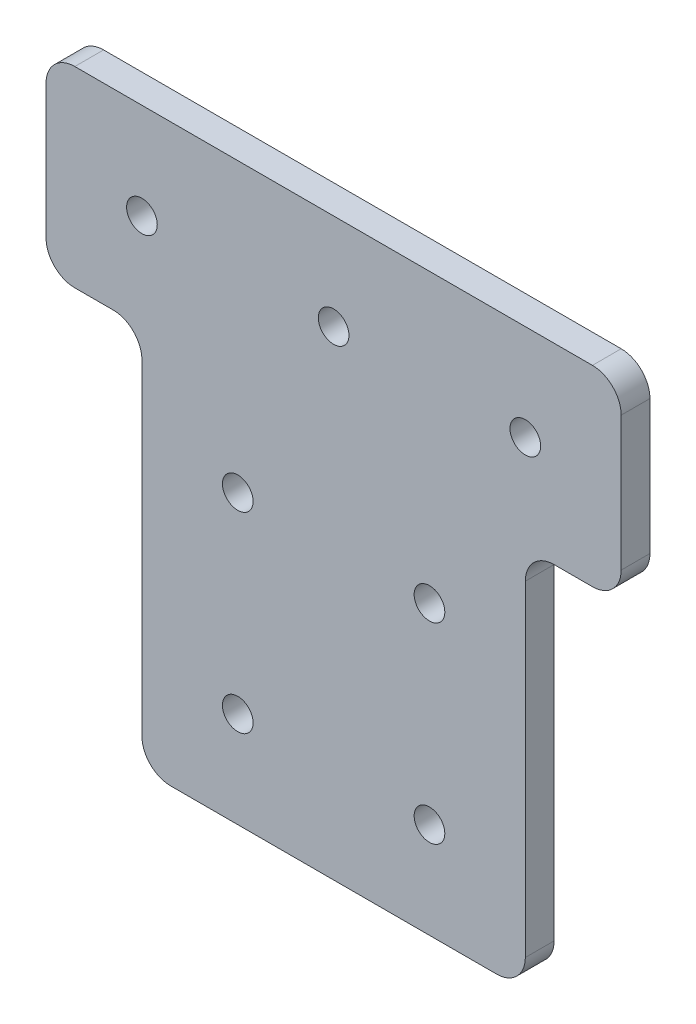
from build123d import *

# Parameters (mm, degrees)
EXTRUDE_1_DEPTH     = 3
CUT_EXTRUDE_1_REACH = 52.09
SKETCH_2_R          = 1.6
FILLET_1_R          = 3
FILLET_2_R          = 3


with BuildPart() as part:
    # 草图1 → 凸台-拉伸1 (new body)
    with BuildSketch(Plane.XY):
        Polygon((-20, 20), (-30, 20), (-30, 40), (30, 40), (30, 20), (20, 20), (20, -20), (-20, -20), align=None)
    extrude(amount=EXTRUDE_1_DEPTH)

    # 草图2 → 切除-拉伸1 (cut, up to next)
    with BuildSketch(Plane.XY.offset(3), mode=Mode.PRIVATE) as cut_extrude_1_sk1:
        with Locations((-20, 30)):
            Circle(SKETCH_2_R)
    cut_extrude_1_tool1 = extrude(cut_extrude_1_sk1.sketch, amount=-CUT_EXTRUDE_1_REACH, mode=Mode.PRIVATE) & part.part
    # 草图2 → 切除-拉伸1 (cut, up to next)
    with BuildSketch(Plane.XY.offset(3), mode=Mode.PRIVATE) as cut_extrude_1_sk2:
        with Locations((0, 30)):
            Circle(SKETCH_2_R)
    cut_extrude_1_tool2 = extrude(cut_extrude_1_sk2.sketch, amount=-CUT_EXTRUDE_1_REACH, mode=Mode.PRIVATE) & part.part
    # 草图2 → 切除-拉伸1 (cut, up to next)
    with BuildSketch(Plane.XY.offset(3), mode=Mode.PRIVATE) as cut_extrude_1_sk3:
        with Locations((20, 30)):
            Circle(SKETCH_2_R)
    cut_extrude_1_tool3 = extrude(cut_extrude_1_sk3.sketch, amount=-CUT_EXTRUDE_1_REACH, mode=Mode.PRIVATE) & part.part
    # 草图2 → 切除-拉伸1 (cut, up to next)
    with BuildSketch(Plane.XY.offset(3), mode=Mode.PRIVATE) as cut_extrude_1_sk4:
        with Locations((-10, -10)):
            Circle(SKETCH_2_R)
    cut_extrude_1_tool4 = extrude(cut_extrude_1_sk4.sketch, amount=-CUT_EXTRUDE_1_REACH, mode=Mode.PRIVATE) & part.part
    # 草图2 → 切除-拉伸1 (cut, up to next)
    with BuildSketch(Plane.XY.offset(3), mode=Mode.PRIVATE) as cut_extrude_1_sk5:
        with Locations((10, -10)):
            Circle(SKETCH_2_R)
    cut_extrude_1_tool5 = extrude(cut_extrude_1_sk5.sketch, amount=-CUT_EXTRUDE_1_REACH, mode=Mode.PRIVATE) & part.part
    # 草图2 → 切除-拉伸1 (cut, up to next)
    with BuildSketch(Plane.XY.offset(3), mode=Mode.PRIVATE) as cut_extrude_1_sk6:
        with Locations((10, 10)):
            Circle(SKETCH_2_R)
    cut_extrude_1_tool6 = extrude(cut_extrude_1_sk6.sketch, amount=-CUT_EXTRUDE_1_REACH, mode=Mode.PRIVATE) & part.part
    # 草图2 → 切除-拉伸1 (cut, up to next)
    with BuildSketch(Plane.XY.offset(3), mode=Mode.PRIVATE) as cut_extrude_1_sk7:
        with Locations((-10, 10)):
            Circle(SKETCH_2_R)
    cut_extrude_1_tool7 = extrude(cut_extrude_1_sk7.sketch, amount=-CUT_EXTRUDE_1_REACH, mode=Mode.PRIVATE) & part.part
    add(cut_extrude_1_tool1.solids().sort_by_distance((-20, 30, 3))[0], mode=Mode.SUBTRACT)
    add(cut_extrude_1_tool2.solids().sort_by_distance((0, 30, 3))[0], mode=Mode.SUBTRACT)
    add(cut_extrude_1_tool3.solids().sort_by_distance((20, 30, 3))[0], mode=Mode.SUBTRACT)
    add(cut_extrude_1_tool4.solids().sort_by_distance((-10, -10, 3))[0], mode=Mode.SUBTRACT)
    add(cut_extrude_1_tool5.solids().sort_by_distance((10, -10, 3))[0], mode=Mode.SUBTRACT)
    add(cut_extrude_1_tool6.solids().sort_by_distance((10, 10, 3))[0], mode=Mode.SUBTRACT)
    add(cut_extrude_1_tool7.solids().sort_by_distance((-10, 10, 3))[0], mode=Mode.SUBTRACT)

    # 圆角1
    fillet_1_edges = [part.edges().sort_by_distance(p)[0] for p in [
        (20, -20, 1.5),
        (-20, -20, 1.5),
        (-30, 20, 1.5),
        (-30, 40, 1.5),
        (30, 40, 1.5),
        (30, 20, 1.5),
    ]]
    fillet(fillet_1_edges, radius=FILLET_1_R)

    # 圆角2
    fillet_2_edges = [part.edges().sort_by_distance(p)[0] for p in [
        (-20, 20, 1.5),
        (20, 20, 1.5),
    ]]
    fillet(fillet_2_edges, radius=FILLET_2_R)


solid = part.part
